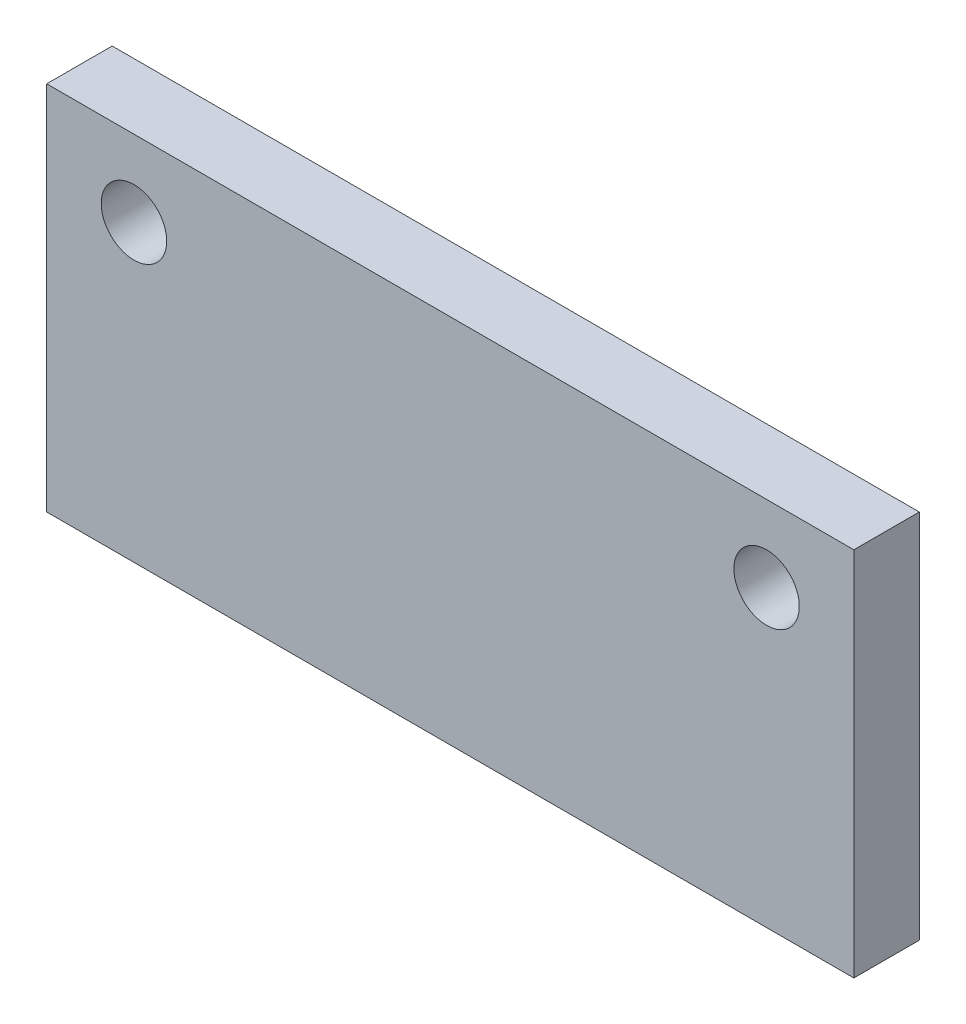
from build123d import *

# Parameters (mm, degrees)
CROQUIS1_W              = 37
CROQUIS1_H              = 13
SALIENTE_EXTRUIR1_DEPTH = 3
CROQUIS3_W              = 8
CROQUIS3_H              = 7
SALIENTE_EXTRUIR2_DEPTH = 7
CROQUIS6_R              = 1.55
CORTAR_EXTRUIR4_DEPTH   = 8
CROQUIS8_W              = 37
CROQUIS8_H              = 3
SALIENTE_EXTRUIR3_DEPTH = 4
CROQUIS9_R              = 1.5
CORTAR_EXTRUIR5_DEPTH   = 3


with BuildPart() as part:
    # Croquis1 → Saliente-Extruir1 (new body)
    with BuildSketch(Plane.XY):
        with Locations((-34.723076923, 22.103846154)):
            Rectangle(CROQUIS1_W, CROQUIS1_H)
    extrude(amount=SALIENTE_EXTRUIR1_DEPTH)

    # Croquis3 → Saliente-Extruir2 (add)
    with BuildSketch(Plane(origin=(0, 0, 0), x_dir=(-1, 0, 0), z_dir=(0, 0, -1))):
        with Locations((34.723076923, 19.103846154)):
            Rectangle(CROQUIS3_W, CROQUIS3_H)
    extrude(amount=SALIENTE_EXTRUIR2_DEPTH)

    # Croquis6 → Cortar-Extruir4 (cut)
    with BuildSketch(Plane(origin=(-30.723076923, 0, 0), x_dir=(0, 0, -1), z_dir=(1, 0, 0))):
        with Locations((4.200477656, 19.103846154)):
            Circle(CROQUIS6_R)
        with BuildLine():
            Line((4.200477656, 22.603846154), (7, 22.603846154))
            Line((7, 22.603846154), (7, 15.603846154))
            Line((7, 15.603846154), (4.200477656, 15.603846154))
            ThreePointArc((4.200477656, 15.603846154), (6.987743364, 19.103846154), (4.200477656, 22.603846154))
        make_face()
    extrude(amount=-CORTAR_EXTRUIR4_DEPTH, mode=Mode.SUBTRACT)

    # Croquis8 → Saliente-Extruir3 (add)
    with BuildSketch(Plane(origin=(0, 28.603846154, 0), x_dir=(1, 0, 0), z_dir=(0, 1, 0))):
        with Locations((-34.723076923, -1.5)):
            Rectangle(CROQUIS8_W, CROQUIS8_H)
    extrude(amount=SALIENTE_EXTRUIR3_DEPTH)

    # Croquis9 → Cortar-Extruir5 (cut)
    with BuildSketch(Plane(origin=(0, 0, 0), x_dir=(-1, 0, 0), z_dir=(0, 0, -1))):
        with Locations((20.223076923, 29.103846154)):
            Circle(CROQUIS9_R)
        with Locations((49.223076923, 29.103846154)):
            Circle(CROQUIS9_R)
    extrude(amount=-CORTAR_EXTRUIR5_DEPTH, mode=Mode.SUBTRACT)


solid = part.part
